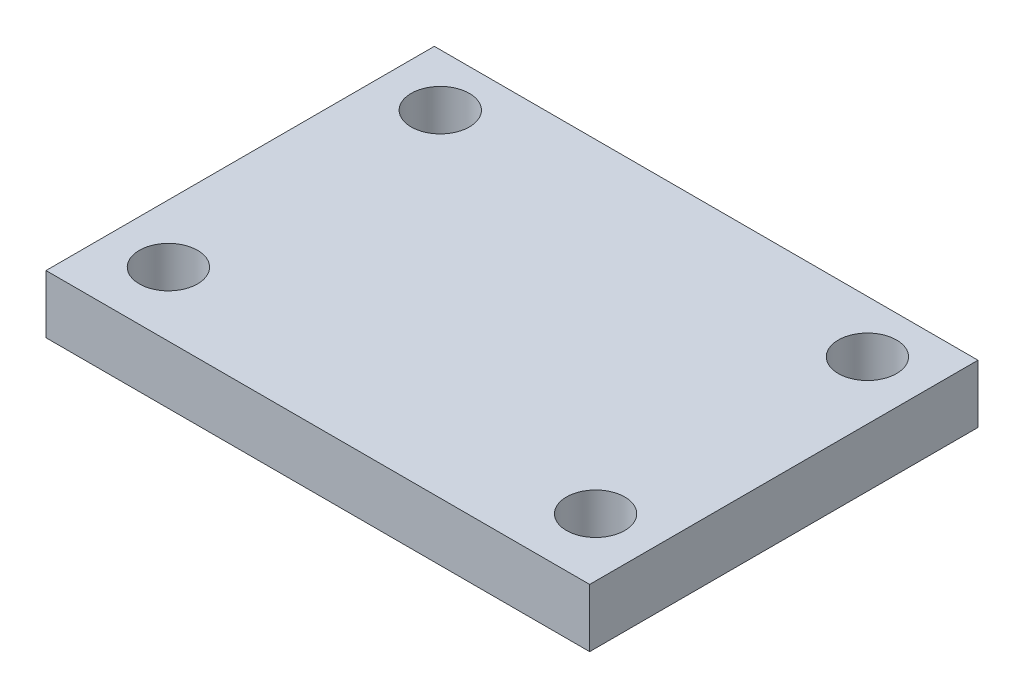
from build123d import *

# Parameters (mm, degrees)
SKETCH1_W                = 28
SKETCH1_H                = 20
BOSS_EXTRUDE1_DEPTH      = 3
F_3_0_3_DIAMETER_HOLE1_D = 3


with BuildPart() as part:
    # Sketch1 → Boss-Extrude1 (new body)
    with BuildSketch(Plane(origin=(0, 0, 0), x_dir=(1, 0, 0), z_dir=(0, 1, 0))):
        Rectangle(SKETCH1_W, SKETCH1_H)
    extrude(amount=BOSS_EXTRUDE1_DEPTH)

    # Ø3.0 (3) Diameter Hole1 (through all)
    with Locations(Plane(origin=(0, 0, 0), x_dir=(-1, 0, 0), z_dir=(0, -1, 0))):
        with Locations((-11, 7.305502846), (11, 7.305502846), (11, -6.694497154), (-11, -6.694497154)):
            Hole(F_3_0_3_DIAMETER_HOLE1_D / 2)


solid = part.part
